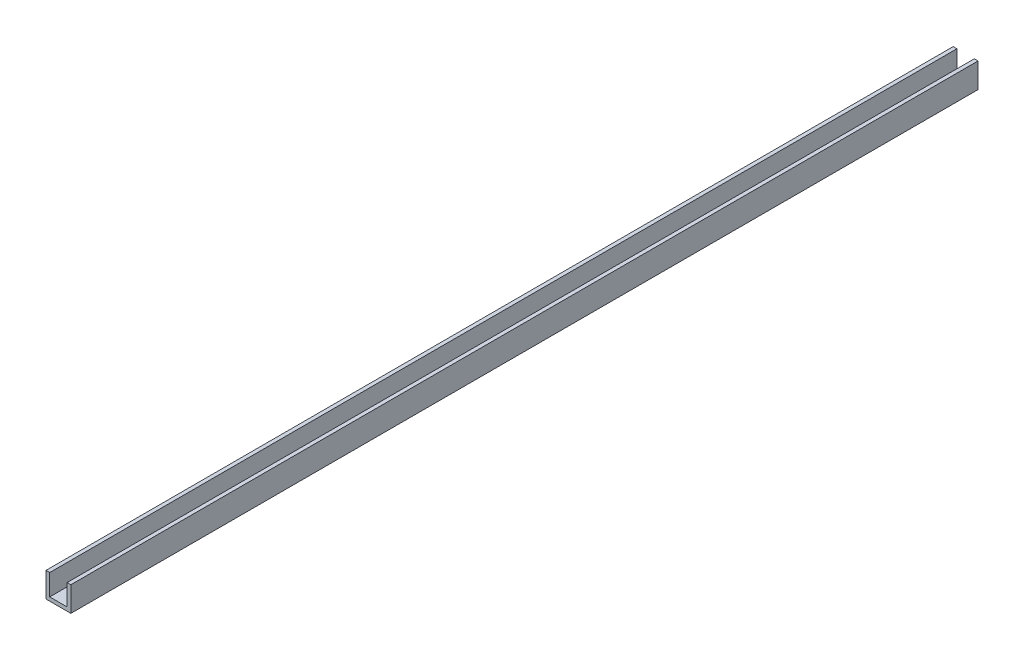
from build123d import *

# Parameters (mm, degrees)
EXTRUDE_1_DEPTH = 365


with BuildPart() as part:
    # Эскиз1 → Бобышка-Вытянуть1 (new body)
    with BuildSketch(Plane.XY):
        Polygon((0, 0), (10, 0), (10, 10), (8.5, 10), (8.5, 1.5), (1.5, 1.5), (1.5, 10), (0, 10), align=None)
    extrude(amount=EXTRUDE_1_DEPTH)


solid = part.part
